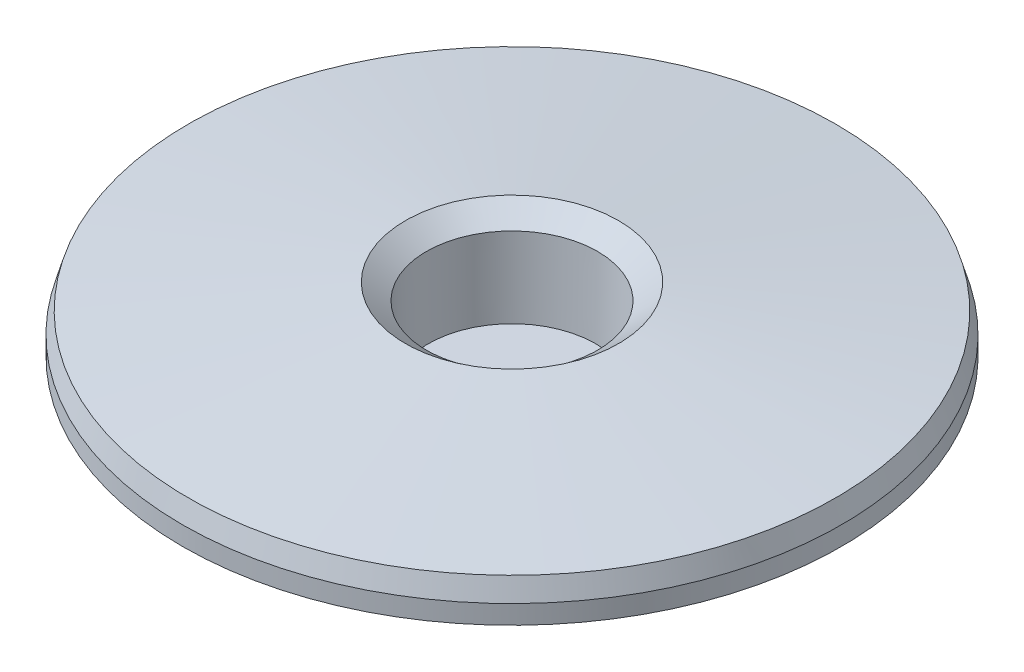
from build123d import *


with BuildPart() as part:
    # Sketch1 → Revolve1 (revolve)
    with BuildSketch(Plane(origin=(0, 0, 0), x_dir=(0, 0, -1), z_dir=(1, 0, 0))):
        Polygon((182.455566, 772.03935), (210.693762, 772.03935), (211.338668, 798.692586), (218.416886, 804.161206), (291.681154, 795.727644), (293.643558, 788.849578), (293.643558, 782.499578), (217.510767311, 791.263340036), (216.89197492, 765.68935), (182.455566, 765.68935), align=None)
    revolve(axis=Axis((0, 765.68935, -182.455566), (0, 1, 0)))


solid = part.part
